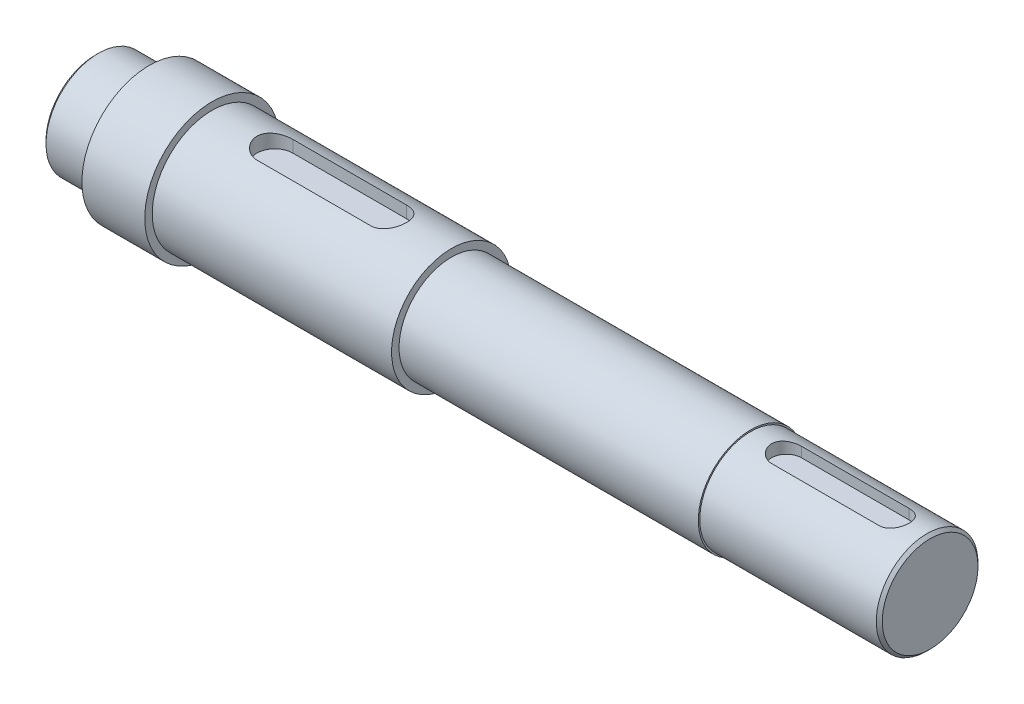
from build123d import *

# Parameters (mm, degrees)
BOSS_EXTRUDE1_DEPTH      = 40
BOSS_EXTRUDE1_DEPTH_BACK = 40
SKETCH1_R                = 20
CUT_EXTRUDE1_DEPTH       = 4.9
SKETCH3_R                = 22.5
BOSS_EXTRUDE2_DEPTH      = 21
SKETCH4_R                = 17.5
BOSS_EXTRUDE3_DEPTH      = 18
CHAMFER1_SIZE            = 1
BOSS_EXTRUDE4_START      = 100
SKETCH5_R                = 17.5
BOSS_EXTRUDE4_DEPTH      = 100
SKETCH6_R                = 17
BOSS_EXTRUDE5_DEPTH      = 60
CUT_EXTRUDE2_DEPTH       = 4.1
CHAMFER2_SIZE            = 1


with BuildPart() as part:
    # Sketch1 → Boss-Extrude1 (new, two sides: drawn at the far end of the back side and taken through both)
    with BuildSketch(Plane(origin=(0, 0, 0), x_dir=(0, 0, -1), z_dir=(1, 0, 0)).offset(-BOSS_EXTRUDE1_DEPTH_BACK)):
        Circle(SKETCH1_R)
    extrude(amount=BOSS_EXTRUDE1_DEPTH + BOSS_EXTRUDE1_DEPTH_BACK)

    # Sketch2 → Cut-Extrude1 (cut)
    with BuildSketch(Plane(origin=(0, 20, 0), x_dir=(1, 0, 0), z_dir=(0, 1, 0))):
        with BuildLine():
            Line((-19, 6), (19, 6))
            ThreePointArc((19, 6), (25, 0), (19, -6))
            Line((19, -6), (-19, -6))
            ThreePointArc((-19, -6), (-25, 0), (-19, 6))
        make_face()
    extrude(amount=-CUT_EXTRUDE1_DEPTH, mode=Mode.SUBTRACT)

    # Sketch3 → Boss-Extrude2 (add)
    with BuildSketch(Plane.ZY.offset(40)):
        Circle(SKETCH3_R)
    extrude(amount=BOSS_EXTRUDE2_DEPTH)

    # Sketch4 → Boss-Extrude3 (add)
    with BuildSketch(Plane.ZY.offset(61)):
        Circle(SKETCH4_R)
    extrude(amount=BOSS_EXTRUDE3_DEPTH)

    # Chamfer1
    chamfer1_edges = [part.edges().sort_by_distance(p)[0] for p in [
        (-79, 0, -17.5),
    ]]
    chamfer(chamfer1_edges, length=CHAMFER1_SIZE)

    # Sketch5 → Boss-Extrude4 (add)
    with BuildSketch(Plane(origin=(40, 0, 0), x_dir=(0, 0, -1), z_dir=(1, 0, 0)).offset(BOSS_EXTRUDE4_START)):
        Circle(SKETCH5_R)
    extrude(amount=-BOSS_EXTRUDE4_DEPTH)

    # Sketch6 → Boss-Extrude5 (add)
    with BuildSketch(Plane(origin=(140, 0, 0), x_dir=(0, 0, -1), z_dir=(1, 0, 0))):
        Circle(SKETCH6_R)
    extrude(amount=BOSS_EXTRUDE5_DEPTH)

    # Sketch7 → Cut-Extrude2 (cut)
    with BuildSketch(Plane(origin=(0, 17, 0), x_dir=(1, 0, 0), z_dir=(0, 1, 0))):
        with BuildLine():
            Line((152, 5), (188, 5))
            ThreePointArc((188, 5), (193, 0), (188, -5))
            Line((188, -5), (152, -5))
            ThreePointArc((152, -5), (147, 0), (152, 5))
        make_face()
    extrude(amount=-CUT_EXTRUDE2_DEPTH, mode=Mode.SUBTRACT)

    # Chamfer2
    chamfer2_edges = [part.edges().sort_by_distance(p)[0] for p in [
        (200, 0, 17),
    ]]
    chamfer(chamfer2_edges, length=CHAMFER2_SIZE)


solid = part.part
